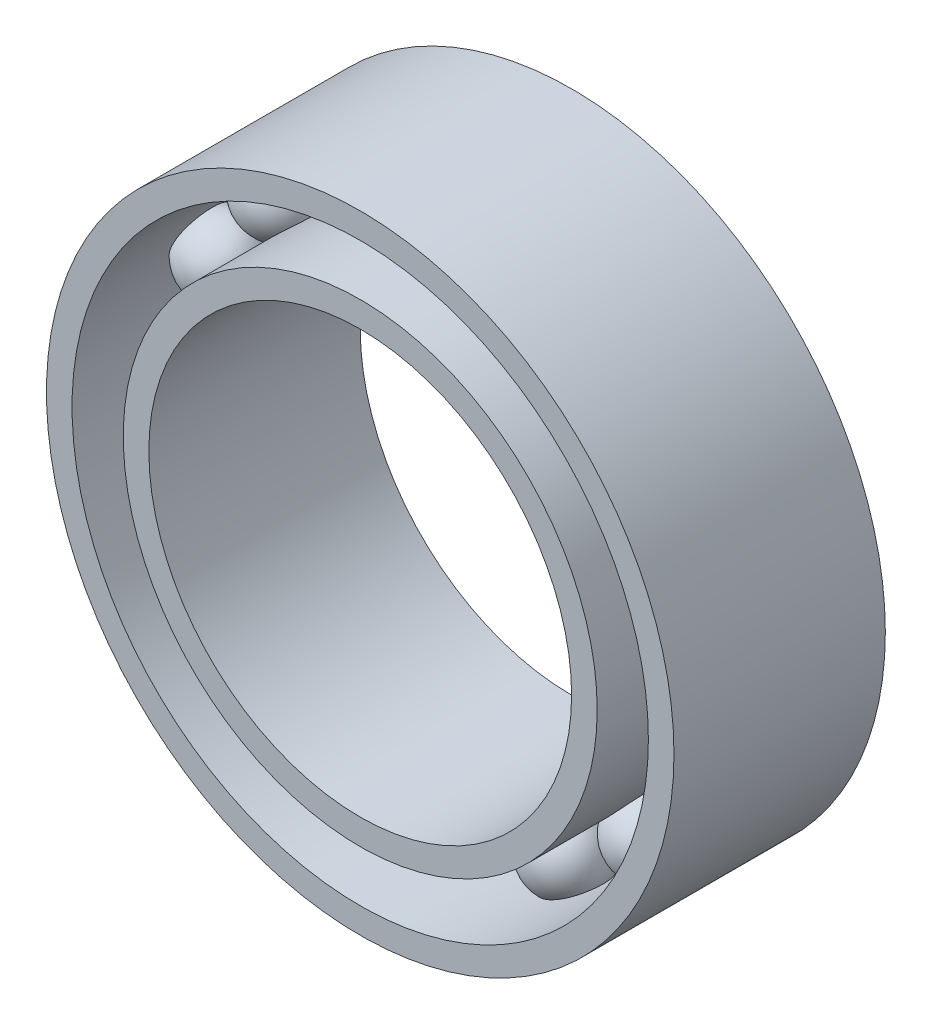
from build123d import *

# Parameters (mm, degrees)
SKETCH1_R           = 4.75
SKETCH1_R_2         = 3.2
BOSS_EXTRUDE1_DEPTH = 3.2
CUT_EXTRUDE1_REACH  = 9.441
SKETCH2_R           = 4.3625
SKETCH2_R_2         = 3.5875
CIRPATTERN1_COUNT   = 16


with BuildPart() as part:
    # Sketch1 → Boss-Extrude1 (new body)
    with BuildSketch(Plane.XY):
        Circle(SKETCH1_R)
        Circle(SKETCH1_R_2, mode=Mode.SUBTRACT)
    extrude(amount=BOSS_EXTRUDE1_DEPTH)

    # Sketch2 → Cut-Extrude1 (cut, up to next)
    with BuildSketch(Plane.XY, mode=Mode.PRIVATE) as cut_extrude1_sk1:
        Circle(SKETCH2_R)
        Circle(SKETCH2_R_2, mode=Mode.SUBTRACT)
    cut_extrude1_tool1 = extrude(cut_extrude1_sk1.sketch, amount=CUT_EXTRUDE1_REACH, mode=Mode.PRIVATE) & part.part
    add(cut_extrude1_tool1.solids().sort_by_distance((-4.23911, 0, 0))[0], mode=Mode.SUBTRACT)


with BuildPart() as cut_extrude1_piece_1:
    # of the separate pieces the step leaves, piece 1, a body of its own (cut_extrude1_pieces)
    add(part.part.solids().sort_by_distance((4.75, 0, 0))[0])



with BuildPart() as cut_extrude1_piece_2:
    # of the separate pieces the step leaves, piece 2, a body of its own (cut_extrude1_pieces)
    add(part.part.solids().sort_by_distance((3.5875, 0, 0))[0])


with BuildPart() as cut_extrude1_piece_1_1:
    add(cut_extrude1_piece_1.part)

    add(cut_extrude1_piece_2.part)  # Revolve1 merges Cut-Extrude1 piece 2
    # Sketch3 → Revolve1 (revolve)
    with BuildSketch(Plane(origin=(0, 0, 0), x_dir=(0, 0, -1), z_dir=(1, 0, 0))):
        with BuildLine():
            Line((-1.6, 4.55625), (-1.6, 3.39375))
            ThreePointArc((-1.6, 3.39375), (-1.01875, 3.975), (-1.6, 4.55625))
        make_face()
    revolve1 = revolve(axis=Axis((0, 4.55625, 1.6), (0, -1, 0)))

    # CirPattern1: Revolve1 ×16 about axis
    cirpattern1_axis = Axis((0, 0, -0.2), (0, 0, 1))
    for i in range(1, CIRPATTERN1_COUNT):
        add(revolve1.rotate(cirpattern1_axis, i * 360 / CIRPATTERN1_COUNT))


solid = cut_extrude1_piece_1_1.part
